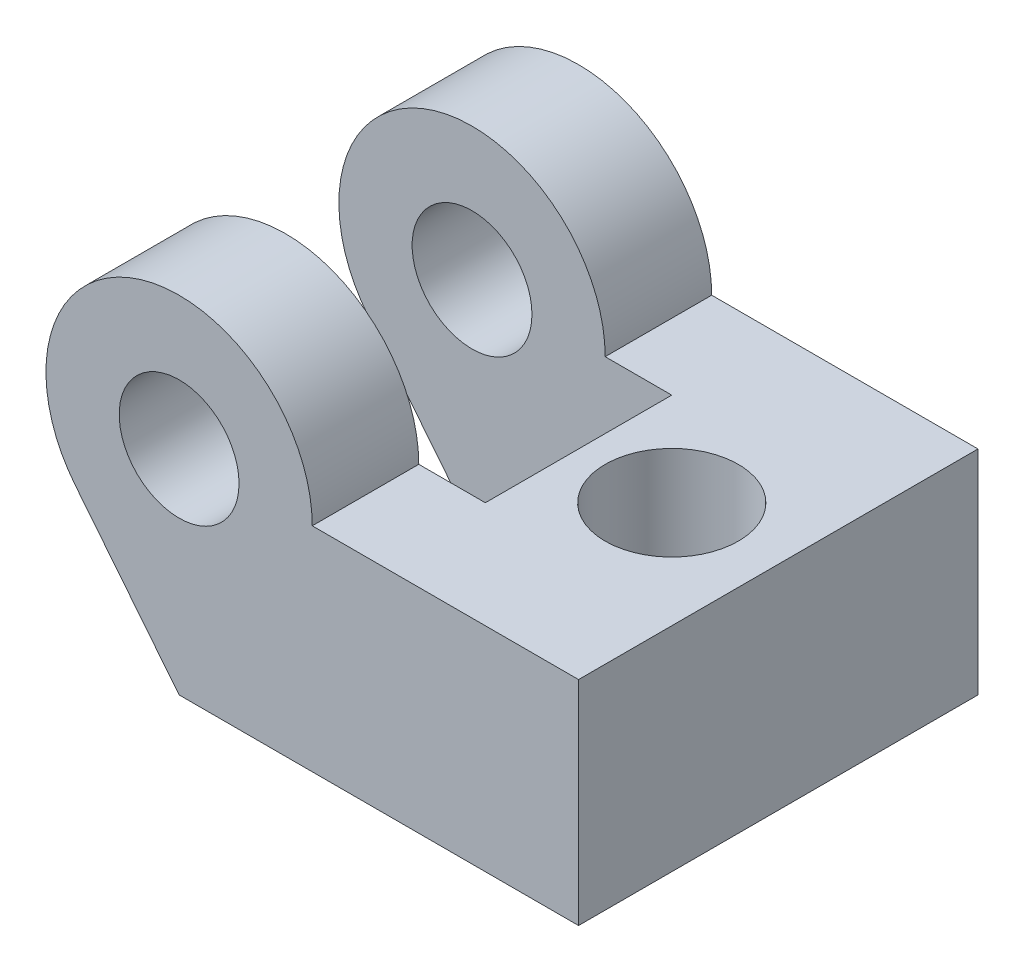
from build123d import *

# Parameters (mm, degrees)
SKETCH1_W           = 15
SKETCH1_H           = 15
BOSS_EXTRUDE1_DEPTH = 8
BOSS_EXTRUDE2_DEPTH = 4
SKETCH3_R           = 7.5
CUT_EXTRUDE1_DEPTH  = 7
SKETCH4_R           = 2.25
CUT_EXTRUDE2_DEPTH  = 29.178005607
SKETCH5_R           = 2.5
CUT_EXTRUDE3_DEPTH  = 23.808989456


with BuildPart() as part:
    # Sketch1 → Boss-Extrude1 (new body)
    with BuildSketch(Plane(origin=(0, 0, 0), x_dir=(1, 0, 0), z_dir=(0, 1, 0))):
        with Locations((-7.5, 0)):
            Rectangle(SKETCH1_W, SKETCH1_H)
    extrude(amount=BOSS_EXTRUDE1_DEPTH)

    # Sketch2 → Boss-Extrude2 (add)
    with BuildSketch(Plane.XY.offset(7.5)):
        with BuildLine():
            Line((-18.903123749, 4.875), (-15, 0))
            Line((-15, 0), (-15, 3))
            ThreePointArc((-15, 3), (-12.834936491, 12.506939094), (-18.903123749, 4.875))
        make_face()
    boss_extrude2 = extrude(amount=-BOSS_EXTRUDE2_DEPTH)

    # Mirror1: Boss-Extrude2 across plane
    add(boss_extrude2.mirror(Plane.XY))

    # Sketch3 → Cut-Extrude1 (cut)
    with BuildSketch(Plane.XY.offset(-3.5)):
        with Locations((-15, 8)):
            Circle(SKETCH3_R)
    extrude(amount=CUT_EXTRUDE1_DEPTH, mode=Mode.SUBTRACT)

    # Sketch4 → Cut-Extrude2 (cut, through all)
    with BuildSketch(Plane.XY.offset(7.5)):
        with Locations((-15, 8)):
            Circle(SKETCH4_R)
    extrude(amount=-CUT_EXTRUDE2_DEPTH, mode=Mode.SUBTRACT)

    # Sketch5 → Cut-Extrude3 (cut, through all)
    with BuildSketch(Plane(origin=(0, 8, 0), x_dir=(1, 0, 0), z_dir=(0, 1, 0))):
        with Locations(Location((-4, 0, 0), (0, 0, 270))):
            Circle(SKETCH5_R)
    extrude(amount=-CUT_EXTRUDE3_DEPTH, mode=Mode.SUBTRACT)


solid = part.part
